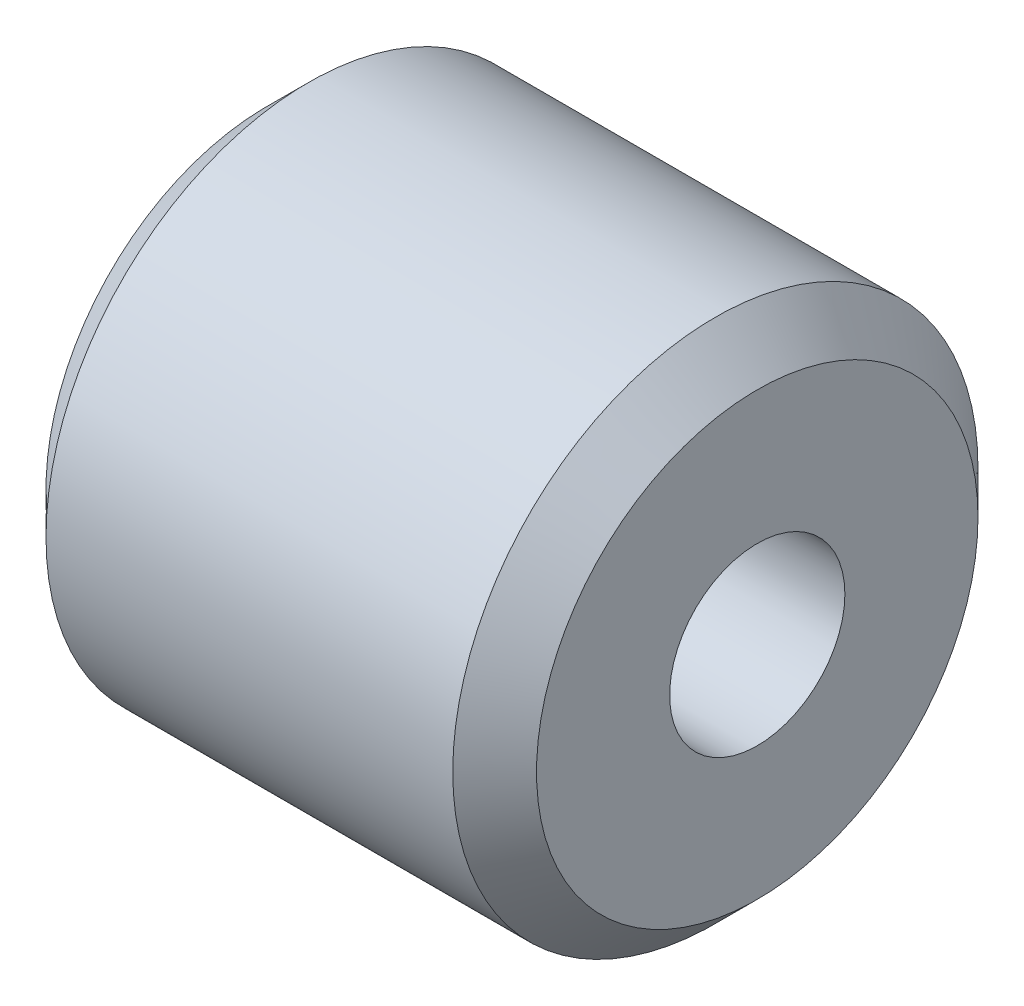
from build123d import *

# Parameters (mm, degrees)
SKETCH2_R           = 4.765
SKETCH2_R_2         = 1.59
BOSS_EXTRUDE1_DEPTH = 4.45
CHAMFER1_SIZE       = 0.76


with BuildPart() as part:
    # Sketch2 → Boss-Extrude1 (new, symmetric)
    with BuildSketch(Plane(origin=(0, 0, 0), x_dir=(0, 0, -1), z_dir=(1, 0, 0))):
        Circle(SKETCH2_R)
        Circle(SKETCH2_R_2, mode=Mode.SUBTRACT)
    extrude(amount=BOSS_EXTRUDE1_DEPTH, both=True)

    # Chamfer1
    chamfer1_edges = [part.edges().sort_by_distance(p)[0] for p in [
        (-4.45, 0, 4.765),
        (4.45, 0, 4.765),
    ]]
    chamfer(chamfer1_edges, length=CHAMFER1_SIZE)


solid = part.part
